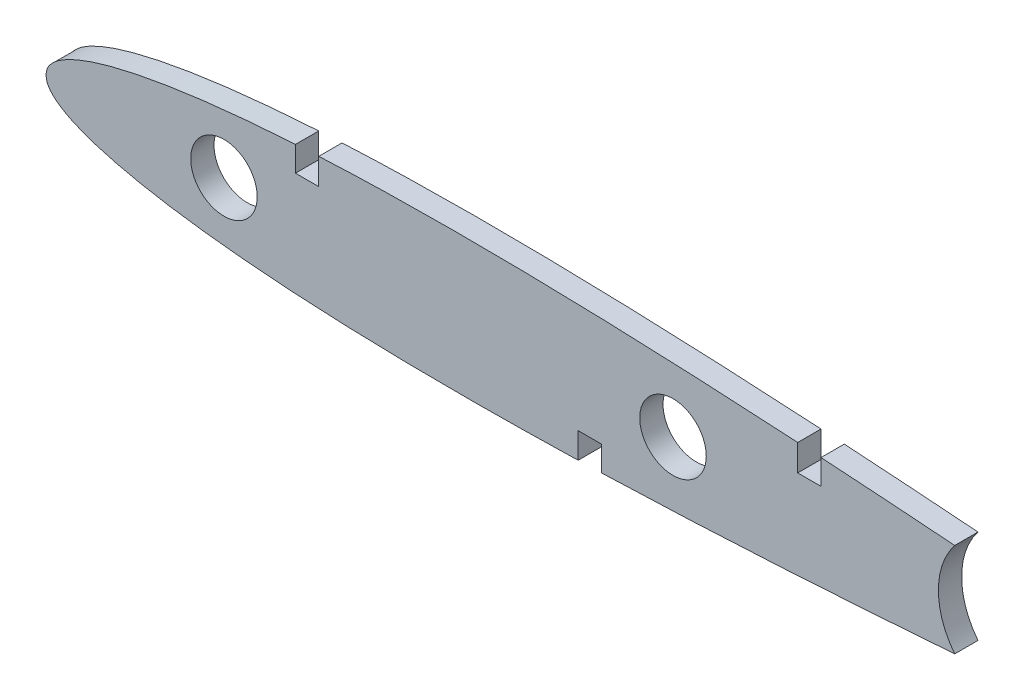
from build123d import *

# Parameters (mm, degrees)
SKETCH_1_R      = 4
EXTRUDE_1_DEPTH = 1.4


with BuildPart() as part:
    # Эскиз1 → Бобышка-Вытянуть1 (new, symmetric)
    with BuildSketch(Plane.XY):
        with BuildLine():
            ThreePointArc((142.879654521, -5.645889143), (140.91290042, 0), (142.879654521, 5.645889143))
            add(Edge.make_bspline(
                [(142.879654521, 5.645889143), (142.747268556, 5.655935735), (140.983089587, 5.789556497), (137.585492165, 6.040187447), (132.68922042, 6.382393711), (129.093359344, 6.61888416), (127.131231234, 6.742693318), (126.8, 6.763442063)],
                knots=[0.339950039, 0.339950039, 0.339950039, 0.339950039, 0.342309554, 0.371392651, 0.400495753, 0.429537687, 0.435435831, 0.435435831, 0.435435831, 0.435435831], degree=3))
            Line((126.8, 6.763442063), (126.8, 3.763442063))
            Line((126.8, 3.763442063), (124, 3.763442063))
            Line((124, 3.763442063), (124, 6.935165252))
            add(Edge.make_bspline(
                [(124, 6.935165252), (123.641212233, 6.956691636), (121.670677761, 7.073894152), (118.103435227, 7.275698401), (113.316671904, 7.521871639), (108.586398202, 7.738792494), (103.923211277, 7.924514665), (99.337253306, 8.077210344), (94.83828356, 8.195186848), (90.435677893, 8.276886408), (86.138497273, 8.320981466), (81.955490955, 8.326384834), (77.89513162, 8.292131727), (73.965623193, 8.217718888), (70.174939177, 8.10268745), (67.668791632, 7.99564794), (66.426868705, 7.933879191), (66.4, 7.93253874)],
                knots=[0.452054102, 0.452054102, 0.452054102, 0.452054102, 0.458441906, 0.487136114, 0.515551917, 0.543623847, 0.571289985, 0.59849081, 0.625169613, 0.651272029, 0.676746158, 0.701541791, 0.725611017, 0.748907835, 0.771387785, 0.793008139, 0.793486237, 0.793486237, 0.793486237, 0.793486237], degree=3))
            Line((66.4, 7.93253874), (66.4, 4.777447755))
            Line((66.4, 4.777447755), (63.6, 4.777447755))
            Line((63.6, 4.777447755), (63.6, 7.777447755))
            add(Edge.make_bspline(
                [(63.6, 7.777447755), (63.396162512, 7.764994786), (62.081509824, 7.682983398), (59.712211754, 7.515019975), (56.552200858, 7.239849215), (53.56772758, 6.926570619), (50.765590148, 6.57637304), (48.152410031, 6.190731972), (45.734630901, 5.771261543), (43.518525859, 5.319707647), (41.510178464, 4.837901503), (39.715362287, 4.3277629), (38.139724526, 3.791042715), (36.787821083, 3.229441513), (35.665157045, 2.644102252), (34.771002159, 2.034538769), (34.118995376, 1.396849457), (33.68372682, 0.718681816), (33.626994167, 0.231708516), (33.6, 0)],
                knots=[0.810098727, 0.810098727, 0.810098727, 0.810098727, 0.813728033, 0.833507815, 0.852309696, 0.87009731, 0.886835918, 0.902492782, 0.917037139, 0.930441054, 0.942679762, 0.953733567, 0.963589785, 0.972247019, 0.979722225, 0.986065145, 0.991385258, 0.995900989, 1, 1, 1, 1], degree=3))
            add(Edge.make_bspline(
                [(33.6, 0), (33.626994167, -0.231708516), (33.68372682, -0.718681816), (34.118995376, -1.396849457), (34.771002159, -2.034538769), (35.665157045, -2.644102252), (36.787821083, -3.229441513), (38.139724526, -3.791042715), (39.715362287, -4.3277629), (41.510178464, -4.837901503), (43.518525859, -5.319707647), (45.734630901, -5.771261543), (48.152410031, -6.190731972), (50.765590148, -6.57637304), (53.56772758, -6.926570619), (56.552200858, -7.239849215), (59.712211754, -7.515019975), (63.040803104, -7.750989271), (66.530820659, -7.947044314), (70.174939177, -8.10268745), (73.965623193, -8.217718888), (77.89513162, -8.292131727), (81.955490955, -8.326384834), (86.138497273, -8.320981466), (90.435677893, -8.276886408), (94.268903337, -8.20575289), (96.668631576, -8.146352686), (97.6, -8.121192528)],
                knots=[0, 0, 0, 0, 0.004099011, 0.008614742, 0.013934855, 0.020277775, 0.027752981, 0.036410215, 0.046266433, 0.057320238, 0.069558946, 0.082962861, 0.097507218, 0.113164082, 0.12990269, 0.147690304, 0.166492185, 0.186271967, 0.206991861, 0.228612215, 0.251092165, 0.274388983, 0.298458209, 0.323253842, 0.348727971, 0.374830387, 0.391388582, 0.391388582, 0.391388582, 0.391388582], degree=3))
            Line((97.6, -8.121192528), (97.6, -5.039340517))
            Line((97.6, -5.039340517), (100.4, -5.039340517))
            Line((100.4, -5.039340517), (100.4, -8.039340517))
            add(Edge.make_bspline(
                [(100.400000001, -8.039340517), (101.56572059, -8.002730044), (104.287183669, -7.910018625), (108.586398202, -7.738792494), (113.316671904, -7.521871639), (118.103435227, -7.275698401), (122.935626987, -7.002334081), (127.801626972, -6.703838046), (132.68922042, -6.382393711), (137.585492165, -6.040187447), (140.983089587, -5.789556497), (142.747268556, -5.655935735), (142.879654521, -5.645889143)],
                knots=[0.40798276, 0.40798276, 0.40798276, 0.40798276, 0.428710015, 0.456376153, 0.484448083, 0.512863886, 0.541558094, 0.570462313, 0.599504247, 0.628607349, 0.657690446, 0.660049961, 0.660049961, 0.660049961, 0.660049961], degree=3))
        make_face()
        with Locations((55, 0)):
            Circle(SKETCH_1_R, mode=Mode.SUBTRACT)
        with Locations((109, 0)):
            Circle(SKETCH_1_R, mode=Mode.SUBTRACT)
    extrude(amount=EXTRUDE_1_DEPTH, both=True)


solid = part.part
